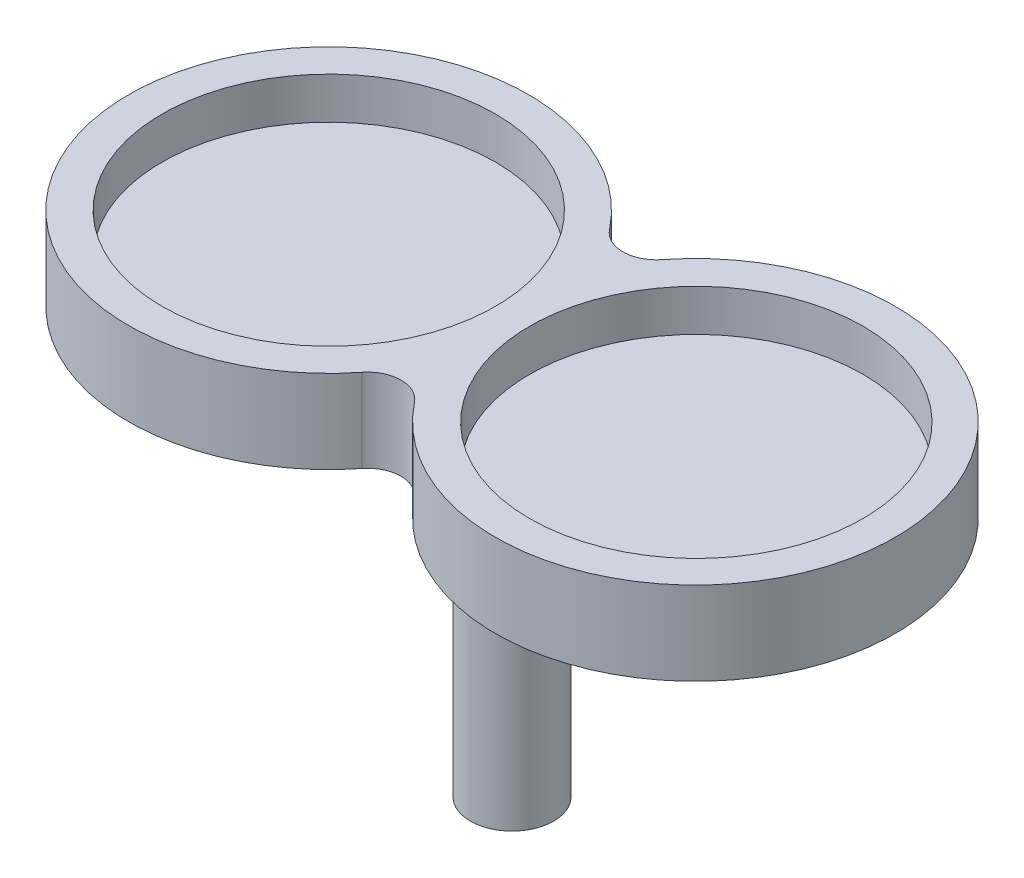
from build123d import *

# Parameters (mm, degrees)
BOSS_EXTRUDE1_DEPTH = 6.35
SKETCH3_R           = 12.7
CUT_EXTRUDE1_DEPTH  = 3.175
SKETCH5_R           = 12.7
CUT_EXTRUDE2_DEPTH  = 3.175
SKETCH6_R           = 3.175
BOSS_EXTRUDE2_DEPTH = 25.4
FILLET1_R           = 2.54


with BuildPart() as part:
    # Sketch2 → Boss-Extrude1 (new body)
    with BuildSketch(Plane(origin=(0, 0, 0), x_dir=(1, 0, 0), z_dir=(0, 1, 0))):
        with BuildLine():
            ThreePointArc((0, -6.090706035), (29.21, 0), (0, 6.090706035))
            ThreePointArc((0, 6.090706035), (-29.21, 0), (0, -6.090706035))
        make_face()
    extrude(amount=BOSS_EXTRUDE1_DEPTH)

    # Sketch3 → Cut-Extrude1 (cut)
    with BuildSketch(Plane(origin=(0, 6.35, 0), x_dir=(1, 0, 0), z_dir=(0, 1, 0))):
        with Locations(Location((-13.959659088, 0, 0), (0, 0, 270))):
            Circle(SKETCH3_R)
    extrude(amount=-CUT_EXTRUDE1_DEPTH, mode=Mode.SUBTRACT)

    # Sketch5 → Cut-Extrude2 (cut)
    with BuildSketch(Plane(origin=(0, 6.35, 0), x_dir=(1, 0, 0), z_dir=(0, 1, 0))):
        with Locations(Location((14.045562682, 0, 0), (0, 0, 270))):
            Circle(SKETCH5_R)
    extrude(amount=-CUT_EXTRUDE2_DEPTH, mode=Mode.SUBTRACT)

    # Sketch6 → Boss-Extrude2 (add)
    with BuildSketch(Plane(origin=(0, 0, 0), x_dir=(-1, 0, 0), z_dir=(0, -1, 0))):
        with Locations(Location((0, 0, 0), (0, 0, 270))):
            Circle(SKETCH6_R)
    extrude(amount=BOSS_EXTRUDE2_DEPTH)

    # Fillet1
    fillet1_edges = [part.edges().sort_by_distance(p)[0] for p in [
        (0, 0, -3.175),
        (0, 3.175, -6.090706035),
        (0, 3.175, 6.090706035),
    ]]
    fillet(fillet1_edges, radius=FILLET1_R)


solid = part.part
